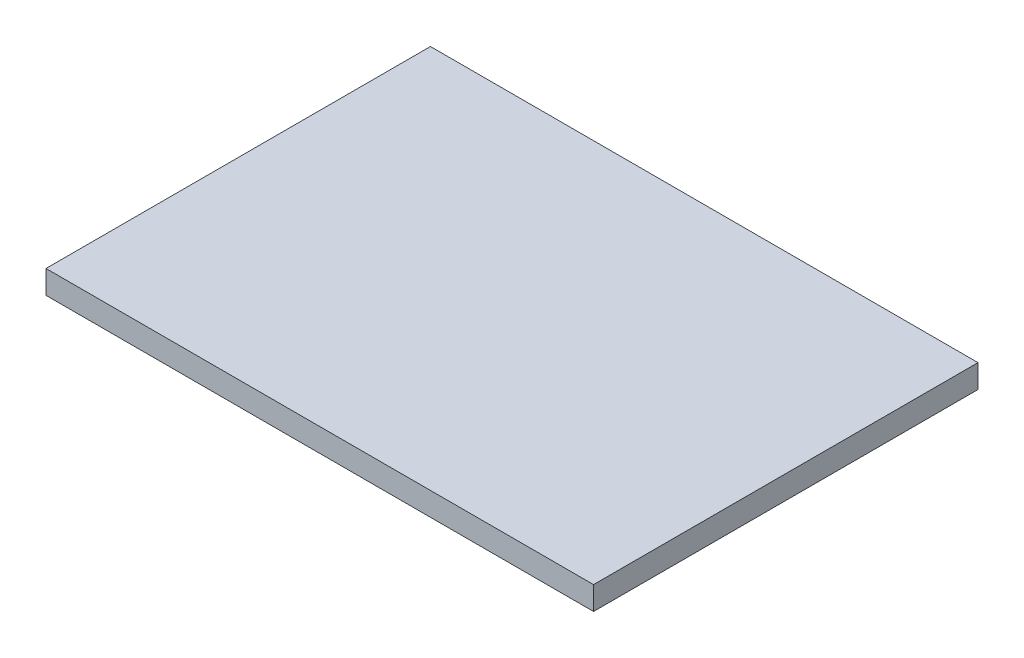
from build123d import *

# Parameters (mm, degrees)
SKETCH1_W           = 94
SKETCH1_H           = 66
BOSS_EXTRUDE1_DEPTH = 4


with BuildPart() as part:
    # Sketch1 → Boss-Extrude1 (new body)
    with BuildSketch(Plane(origin=(0, 0, 0), x_dir=(1, 0, 0), z_dir=(0, 1, 0))):
        Rectangle(SKETCH1_W, SKETCH1_H)
    extrude(amount=BOSS_EXTRUDE1_DEPTH)


solid = part.part
